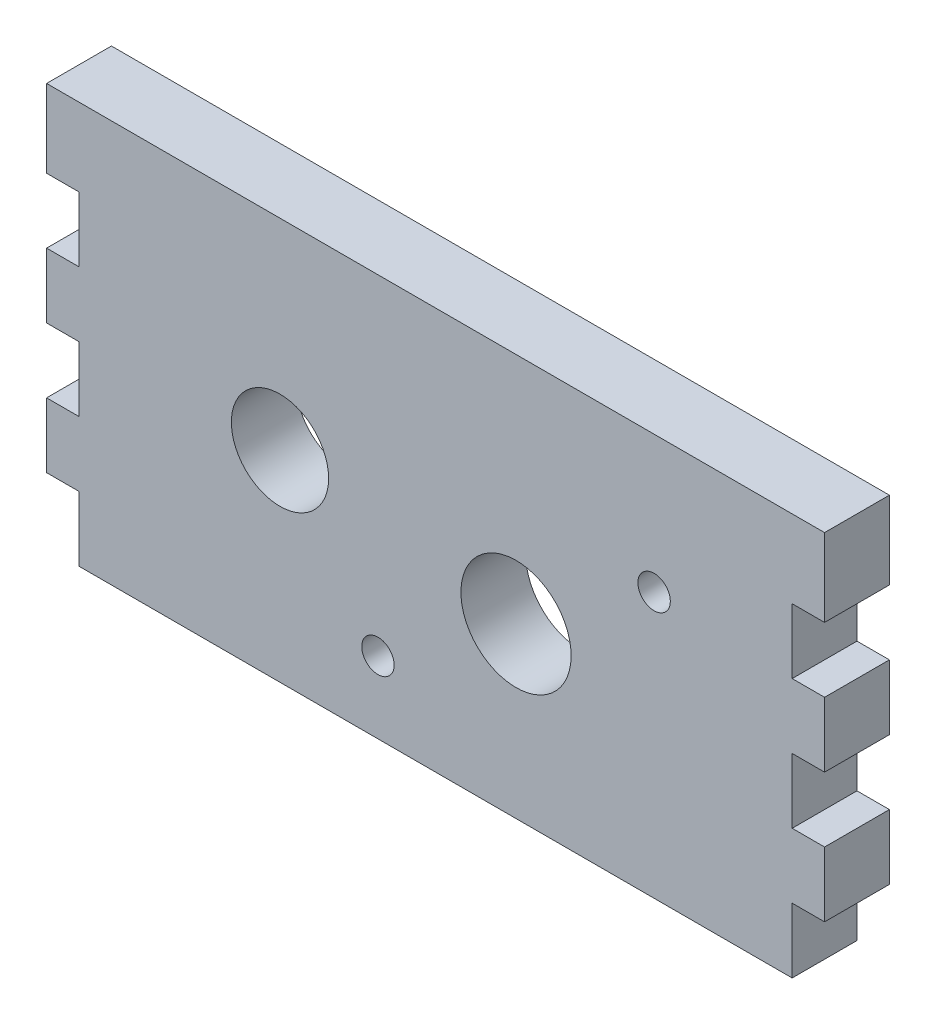
from build123d import *

# Parameters (mm, degrees)
SKETCH_2_W               = 120
SKETCH_2_H               = 62
SKETCH_2_R               = 8.5
SKETCH_2_R_2             = 7.5
SKETCH_2_R_3             = 2.5
EXTRUDE_1_DEPTH          = 10
CUT_EXTRUDE_1_REACH      = 70.272
SKETCH_3_W               = 5
SKETCH_3_H               = 10
PATTERN_LINEAR_1_COUNT   = 3
PATTERN_LINEAR_1_PITCH   = 20
MIRROR_1_COPY_1_REACH    = 70.272
MIRROR_1_COPY_1_SKETCH_W = 5
MIRROR_1_COPY_1_SKETCH_H = 10
MIRROR_1_COPY_2_REACH    = 70.272
MIRROR_1_COPY_2_SKETCH_W = 5
MIRROR_1_COPY_2_SKETCH_H = 10


with BuildPart() as part:
    # 스케치2 → 보스-돌출1 (new body)
    with BuildSketch(Plane.XY):
        Rectangle(SKETCH_2_W, SKETCH_2_H)
        with Locations((12.408275183, -5)):
            Circle(SKETCH_2_R, mode=Mode.SUBTRACT)
        with Locations((-24, 0)):
            Circle(SKETCH_2_R_2, mode=Mode.SUBTRACT)
        with Locations((33.706228335, 9.912987345)):
            Circle(SKETCH_2_R_3, mode=Mode.SUBTRACT)
        with Locations((-8.889677969, -19.912987345)):
            Circle(SKETCH_2_R_3, mode=Mode.SUBTRACT)
    extrude(amount=EXTRUDE_1_DEPTH)

    # 스케치3 → 컷-돌출1 (cut, up to next)
    with BuildSketch(Plane.XY.offset(10), mode=Mode.PRIVATE) as cut_extrude_1_sk1:
        with Locations((-57.5, -26)):
            Rectangle(SKETCH_3_W, SKETCH_3_H)
    cut_extrude_1_tool1 = extrude(cut_extrude_1_sk1.sketch, amount=-CUT_EXTRUDE_1_REACH, mode=Mode.PRIVATE) & part.part
    cut_extrude_1 = cut_extrude_1_tool1.solids().sort_by_distance((-57.5, -26, 10))[0]
    add(cut_extrude_1, mode=Mode.SUBTRACT)

    # 선형 패턴1: 컷-돌출1 ×3
    with Locations(*[(0, i * PATTERN_LINEAR_1_PITCH, 0) for i in range(1, PATTERN_LINEAR_1_COUNT)]):
        add(cut_extrude_1, mode=Mode.SUBTRACT)

    # 대칭 복사1: 컷-돌출1 across plane
    add(cut_extrude_1.mirror(Plane(origin=(0, 0, 0), x_dir=(0, 0, 1), z_dir=(1, 0, 0))), mode=Mode.SUBTRACT)

    # 대칭 복사1 copy 1 sketch → 대칭 복사1 copy 1 (cut, up to next)
    with BuildSketch(Plane(origin=(0, 20, 10), x_dir=(-1, 0, 0), z_dir=(0, 0, 1)), mode=Mode.PRIVATE) as mirror_1_copy_1_sk1:
        with Locations((-57.5, 26)):
            Rectangle(MIRROR_1_COPY_1_SKETCH_W, MIRROR_1_COPY_1_SKETCH_H)
    mirror_1_copy_1_tool1 = extrude(mirror_1_copy_1_sk1.sketch, amount=-MIRROR_1_COPY_1_REACH, mode=Mode.PRIVATE) & part.part
    add(mirror_1_copy_1_tool1.solids().sort_by_distance((57.5, -6, 10))[0], mode=Mode.SUBTRACT)

    # 대칭 복사1 copy 2 sketch → 대칭 복사1 copy 2 (cut, up to next)
    with BuildSketch(Plane(origin=(0, 40, 10), x_dir=(-1, 0, 0), z_dir=(0, 0, 1)), mode=Mode.PRIVATE) as mirror_1_copy_2_sk1:
        with Locations((-57.5, 26)):
            Rectangle(MIRROR_1_COPY_2_SKETCH_W, MIRROR_1_COPY_2_SKETCH_H)
    mirror_1_copy_2_tool1 = extrude(mirror_1_copy_2_sk1.sketch, amount=-MIRROR_1_COPY_2_REACH, mode=Mode.PRIVATE) & part.part
    add(mirror_1_copy_2_tool1.solids().sort_by_distance((57.5, 14, 10))[0], mode=Mode.SUBTRACT)


solid = part.part
